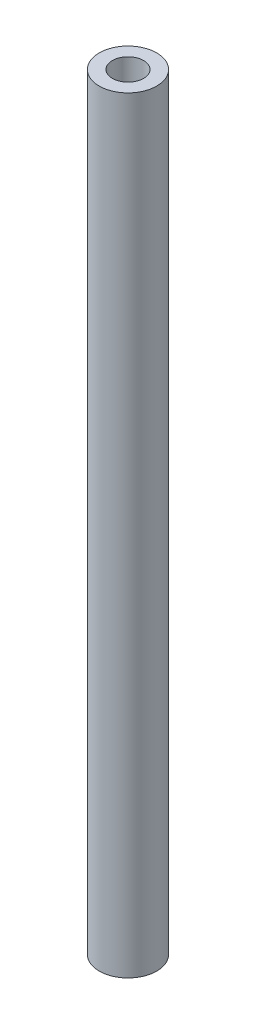
from build123d import *

# Parameters (mm, degrees)
SKETCH1_R           = 7.62
SKETCH1_R_2         = 4.1275
BOSS_EXTRUDE1_DEPTH = 203.2


with BuildPart() as part:
    # Sketch1 → Boss-Extrude1 (new body)
    with BuildSketch(Plane(origin=(0, 0, 0), x_dir=(1, 0, 0), z_dir=(0, 1, 0))):
        with Locations(Location((0, 0, 0), (0, 0, 270))):
            Circle(SKETCH1_R)
        with Locations(Location((0, 0, 0), (0, 0, 270))):
            Circle(SKETCH1_R_2, mode=Mode.SUBTRACT)
    extrude(amount=BOSS_EXTRUDE1_DEPTH)


solid = part.part
